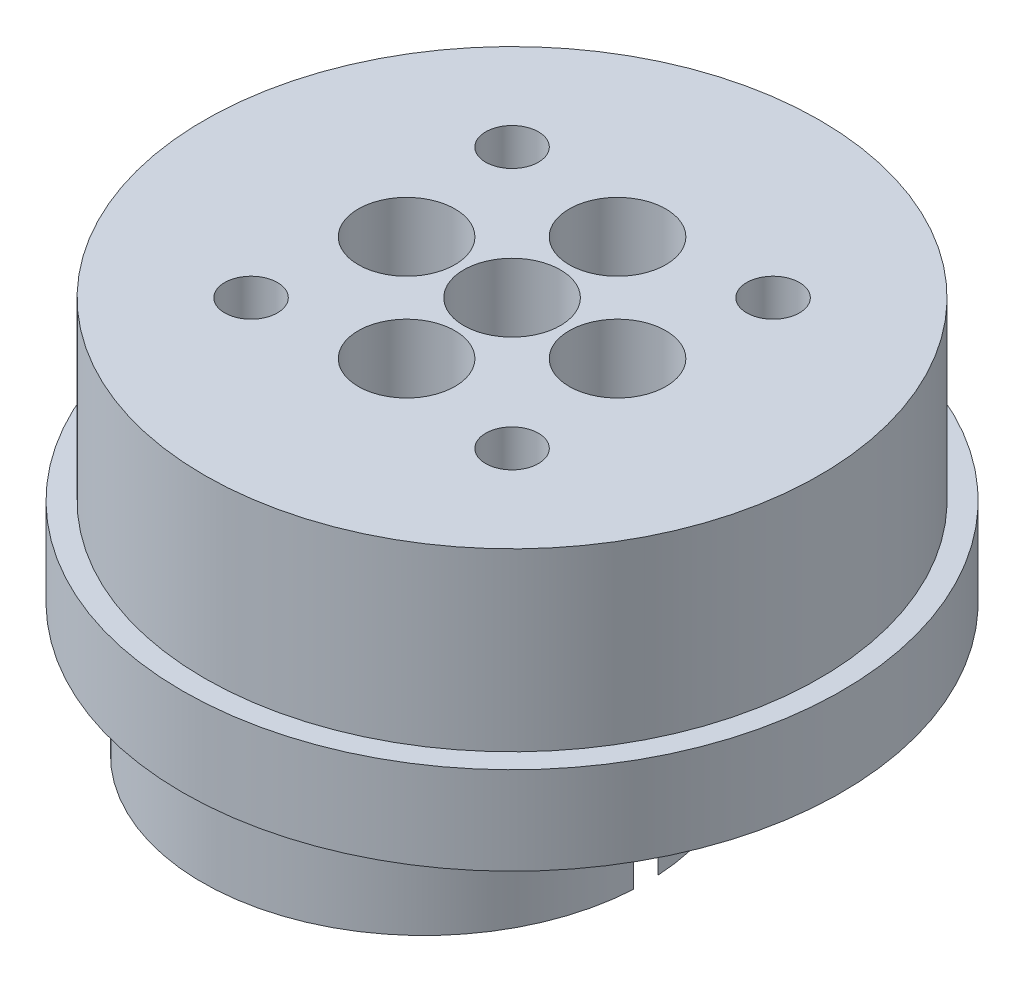
from build123d import *

# Parameters (mm, degrees)
SKETCH1_R                = 15
BOSS_EXTRUDE1_DEPTH      = 5
SKETCH2_R                = 12.6
BOSS_EXTRUDE2_DEPTH      = 10
SKETCH3_R                = 7.5
BOSS_EXTRUDE3_DEPTH      = 5
SKETCH4_R                = 12.625
BOSS_EXTRUDE4_DEPTH      = 10
SKETCH8_R                = 18.75
BOSS_EXTRUDE5_DEPTH      = 5
SKETCH10_R               = 17.5
BOSS_EXTRUDE7_DEPTH      = 10
SKETCH11_R               = 17.65
BOSS_EXTRUDE8_DEPTH      = 10
CUT_EXTRUDE1_REACH       = 63.058
SKETCH12_R               = 1.75
SKETCH12_R_2             = 2.75
CUT_EXTRUDE12_DEPTH      = 53.231456039
CUT_EXTRUDE12_DEPTH_BACK = 53.231456039
SKETCH27_W               = 40.004352786
SKETCH27_H               = 30
BOSS_EXTRUDE11_START     = 2
SKETCH30_R               = 13
SKETCH30_R_2             = 1.75
SKETCH30_R_3             = 2.75
BOSS_EXTRUDE11_DEPTH     = 2
SKETCH31_R               = 1.5
CUT_EXTRUDE13_DEPTH      = 10
SKETCH32_R               = 2.75
CUT_EXTRUDE14_DEPTH      = 4


with BuildPart() as part:
    # Sketch1 → Boss-Extrude1 (new body)
    with BuildSketch(Plane(origin=(0, 0, 0), x_dir=(1, 0, 0), z_dir=(0, 1, 0))):
        with Locations(Location((0, 0, 0), (0, 0, 270))):
            Circle(SKETCH1_R)
    extrude(amount=BOSS_EXTRUDE1_DEPTH)

    # Sketch2 → Boss-Extrude2 (add)
    with BuildSketch(Plane(origin=(0, 5, 0), x_dir=(1, 0, 0), z_dir=(0, 1, 0))):
        with Locations(Location((5, 0, 0), (0, 0, 70.894925587))):
            Circle(SKETCH2_R)
    extrude(amount=BOSS_EXTRUDE2_DEPTH)

    # Sketch3 → Boss-Extrude3 (add)
    with BuildSketch(Plane(origin=(0, 15, 0), x_dir=(1, 0, 0), z_dir=(0, 1, 0))):
        with Locations(Location((0, 0, 0), (0, 0, 270))):
            Circle(SKETCH3_R)
    extrude(amount=BOSS_EXTRUDE3_DEPTH)

    # Sketch4 → Boss-Extrude4 (add)
    with BuildSketch(Plane(origin=(0, 20, 0), x_dir=(1, 0, 0), z_dir=(0, 1, 0))):
        with Locations(Location((-5, 0, 0), (0, 0, 270))):
            Circle(SKETCH4_R)
    extrude(amount=BOSS_EXTRUDE4_DEPTH)

    # Sketch8 → Boss-Extrude5 (add)
    with BuildSketch(Plane(origin=(0, 30, 0), x_dir=(1, 0, 0), z_dir=(0, 1, 0))):
        with Locations(Location((0, 0, 0), (0, 0, 270))):
            Circle(SKETCH8_R)
    extrude(amount=BOSS_EXTRUDE5_DEPTH)

    # Sketch10 → Boss-Extrude7 (add)
    with BuildSketch(Plane(origin=(0, 35, 0), x_dir=(1, 0, 0), z_dir=(0, 1, 0))):
        with Locations(Location((0, 0, 0), (0, 0, 270))):
            Circle(SKETCH10_R)
    extrude(amount=BOSS_EXTRUDE7_DEPTH)

    # Sketch11 → Boss-Extrude8 (add)
    with BuildSketch(Plane.XZ):
        with Locations(Location((0, 0, 0), (0, 0, 270))):
            Circle(SKETCH11_R)
    extrude(amount=BOSS_EXTRUDE8_DEPTH)

    # Cut-Extrude1: up to this face of the body (flat: up to its plane)
    cut_extrude1_end = Plane(part.part.faces().sort_by_distance((0, 45, 0))[0])
    # Sketch12 → Cut-Extrude1 (cut, up to the picked face)
    with BuildSketch(Plane.XZ.offset(10), mode=Mode.PRIVATE) as cut_extrude1_sk1:
        with Locations(Location((0, 6, 0), (0, 0, 270))):
            Circle(SKETCH12_R)
    cut_extrude1_tool1 = split(extrude(cut_extrude1_sk1.sketch, amount=-CUT_EXTRUDE1_REACH, mode=Mode.PRIVATE), bisect_by=cut_extrude1_end, keep=Keep.BOTH, mode=Mode.PRIVATE)
    # Sketch12 → Cut-Extrude1 (cut, up to the picked face)
    with BuildSketch(Plane.XZ.offset(10), mode=Mode.PRIVATE) as cut_extrude1_sk2:
        with Locations(Location((0, -6, 0), (0, 0, 270))):
            Circle(SKETCH12_R)
    cut_extrude1_tool2 = split(extrude(cut_extrude1_sk2.sketch, amount=-CUT_EXTRUDE1_REACH, mode=Mode.PRIVATE), bisect_by=cut_extrude1_end, keep=Keep.BOTH, mode=Mode.PRIVATE)
    # Sketch12 → Cut-Extrude1 (cut, up to the picked face)
    with BuildSketch(Plane.XZ.offset(10), mode=Mode.PRIVATE) as cut_extrude1_sk3:
        with Locations(Location((6, 0, 0), (0, 0, 270))):
            Circle(SKETCH12_R)
    cut_extrude1_tool3 = split(extrude(cut_extrude1_sk3.sketch, amount=-CUT_EXTRUDE1_REACH, mode=Mode.PRIVATE), bisect_by=cut_extrude1_end, keep=Keep.BOTH, mode=Mode.PRIVATE)
    # Sketch12 → Cut-Extrude1 (cut, up to the picked face)
    with BuildSketch(Plane.XZ.offset(10), mode=Mode.PRIVATE) as cut_extrude1_sk4:
        with Locations(Location((-6, 0, 0), (0, 0, 270))):
            Circle(SKETCH12_R)
    cut_extrude1_tool4 = split(extrude(cut_extrude1_sk4.sketch, amount=-CUT_EXTRUDE1_REACH, mode=Mode.PRIVATE), bisect_by=cut_extrude1_end, keep=Keep.BOTH, mode=Mode.PRIVATE)
    # Sketch12 → Cut-Extrude1 (cut, up to the picked face)
    with BuildSketch(Plane.XZ.offset(10), mode=Mode.PRIVATE) as cut_extrude1_sk5:
        with Locations(Location((0, 0, 0), (0, 0, 270))):
            Circle(SKETCH12_R_2)
    cut_extrude1_tool5 = split(extrude(cut_extrude1_sk5.sketch, amount=-CUT_EXTRUDE1_REACH, mode=Mode.PRIVATE), bisect_by=cut_extrude1_end, keep=Keep.BOTH, mode=Mode.PRIVATE)
    add(cut_extrude1_tool1.solids().sort_by(Axis((0, -10, 6), (0, 1, 0)))[0], mode=Mode.SUBTRACT)
    add(cut_extrude1_tool2.solids().sort_by(Axis((0, -10, -6), (0, 1, 0)))[0], mode=Mode.SUBTRACT)
    add(cut_extrude1_tool3.solids().sort_by(Axis((6, -10, 0), (0, 1, 0)))[0], mode=Mode.SUBTRACT)
    add(cut_extrude1_tool4.solids().sort_by(Axis((-6, -10, 0), (0, 1, 0)))[0], mode=Mode.SUBTRACT)
    add(cut_extrude1_tool5.solids().sort_by(Axis((0, -10, 0), (0, 1, 0)))[0], mode=Mode.SUBTRACT)

    # Sketch27 → Cut-Extrude12 (cut, two sides: drawn at the far end of the back side and taken through both)
    with BuildSketch(Plane(origin=(0, 0, 0), x_dir=(0, 0, -1), z_dir=(1, 0, 0)).offset(-CUT_EXTRUDE12_DEPTH_BACK)):
        with Locations((-0.026275673, 5)):
            Rectangle(SKETCH27_W, SKETCH27_H)
    extrude(amount=CUT_EXTRUDE12_DEPTH + CUT_EXTRUDE12_DEPTH_BACK, mode=Mode.SUBTRACT)

    # Sketch30 → Boss-Extrude11 (add)
    with BuildSketch(Plane.XZ.offset(-30).offset(BOSS_EXTRUDE11_START)):
        with Locations(Location((-5, 0, 0), (0, 0, 90))):
            Circle(SKETCH30_R)
        with Locations(Location((0, -6, 0), (0, 0, 90))):
            Circle(SKETCH30_R_2, mode=Mode.SUBTRACT)
        with Locations(Location((-6, 0, 0), (0, 0, 90))):
            Circle(SKETCH30_R_2, mode=Mode.SUBTRACT)
        with Locations(Location((0, 6, 0), (0, 0, 90))):
            Circle(SKETCH30_R_2, mode=Mode.SUBTRACT)
        with Locations(Location((6, 0, 0), (0, 0, 336.579668072))):
            Circle(SKETCH30_R_2, mode=Mode.SUBTRACT)
        with Locations(Location((0, 0, 0), (0, 0, 90))):
            Circle(SKETCH30_R_3, mode=Mode.SUBTRACT)
    extrude(amount=-BOSS_EXTRUDE11_DEPTH)

    # Sketch31 → Cut-Extrude13 (cut)
    with BuildSketch(Plane(origin=(0, 45, 0), x_dir=(1, 0, 0), z_dir=(0, 1, 0))):
        with Locations(Location((-7.424621202, 7.424621202, 0), (0, 0, 270))):
            Circle(SKETCH31_R)
        with Locations(Location((7.424621202, 7.424621202, 0), (0, 0, 270))):
            Circle(SKETCH31_R)
        with Locations(Location((7.424621202, -7.424621202, 0), (0, 0, 270))):
            Circle(SKETCH31_R)
        with Locations(Location((-7.424621202, -7.424621202, 0), (0, 0, 270))):
            Circle(SKETCH31_R)
    extrude(amount=-CUT_EXTRUDE13_DEPTH, mode=Mode.SUBTRACT)

    # Sketch32 → Cut-Extrude14 (cut)
    with BuildSketch(Plane(origin=(0, 45, 0), x_dir=(1, 0, 0), z_dir=(0, 1, 0))):
        with Locations(Location((-6, 0, 0), (0, 0, 270))):
            Circle(SKETCH32_R)
        with Locations(Location((0, 6, 0), (0, 0, 270))):
            Circle(SKETCH32_R)
        with Locations(Location((6, 0, 0), (0, 0, 270))):
            Circle(SKETCH32_R)
        with Locations(Location((0, -6, 0), (0, 0, 270))):
            Circle(SKETCH32_R)
    extrude(amount=-CUT_EXTRUDE14_DEPTH, mode=Mode.SUBTRACT)


solid = part.part
